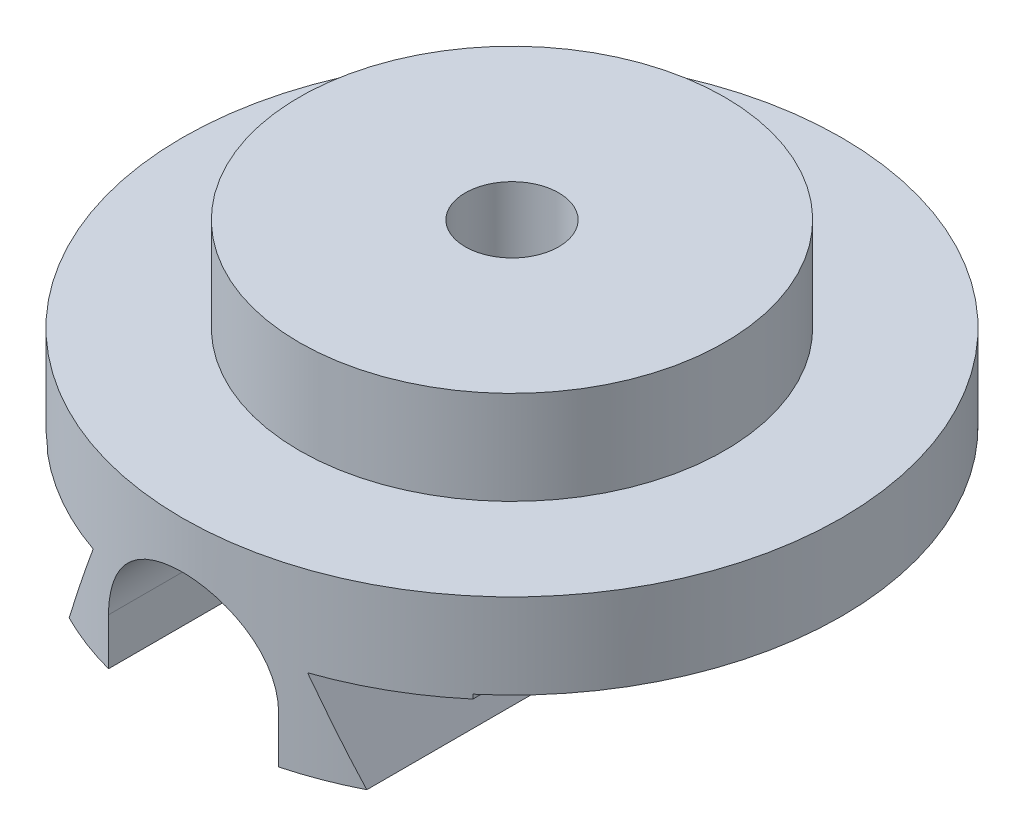
from build123d import *

# Parameters (mm, degrees)
SKETCH1_R           = 8
BOSS_EXTRUDE1_DEPTH = 77.5
SKETCH1_3_W         = 50
SKETCH1_3_H         = 22
CUT_EXTRUDE1_START  = 38
SKETCH1_4_R         = 8
CUT_EXTRUDE1_DEPTH  = 39.5
CUT_EXTRUDE2_START  = -77.5
SKETCH1_5_R         = 8
CUT_EXTRUDE2_DEPTH  = 77.5
SKETCH2_OUTSIDE_W   = 202.67
SKETCH2_OUTSIDE_H   = 202.67
SKETCH2_OUTSIDE_R   = 77.5
CUT_EXTRUDE4_DEPTH  = 77.5
SKETCH4_R           = 11
CUT_EXTRUDE5_DEPTH  = 77.5
SKETCH5_R           = 22.5
CUT_EXTRUDE6_DEPTH  = 42


with BuildPart() as part:
    # Sketch1 → Boss-Extrude1 (new, symmetric)
    with BuildSketch(Plane.XY):
        Polygon((35, 0), (25.207539179, 21), (50, 21), (50, 22), (77.5, 22), (77.5, 42), (-77.5, 42), (-77.5, 22), (-50, 22), (-50, 21), (-25.207539179, 21), (-35, 0), align=None)
        with Locations((0, 11)):
            Circle(SKETCH1_R, mode=Mode.SUBTRACT)
    extrude(amount=BOSS_EXTRUDE1_DEPTH, both=True)

    # Sketch1<3> → Revolve1 (revolve)
    with BuildSketch(Plane.XY):
        with Locations((-25, 53)):
            Rectangle(SKETCH1_3_W, SKETCH1_3_H)
    revolve(axis=Axis((0, 0, 0), (0, 1, 0)))

    # Sketch1<4> → Cut-Extrude1 (cut)
    with BuildSketch(Plane.XY.offset(CUT_EXTRUDE1_START)):
        with BuildLine():
            Line((20, 0), (20, 11))
            ThreePointArc((20, 11), (0, 31), (-20, 11))
            Line((-20, 11), (-20, 0))
            Line((-20, 0), (20, 0))
        make_face()
        with Locations((0, 11)):
            Circle(SKETCH1_4_R, mode=Mode.SUBTRACT)
    extrude(amount=CUT_EXTRUDE1_DEPTH, mode=Mode.SUBTRACT)

    # Sketch1<5> → Cut-Extrude2 (cut)
    with BuildSketch(Plane.XY.offset(CUT_EXTRUDE2_START)):
        with BuildLine():
            Line((14, 0), (14, 11))
            ThreePointArc((14, 11), (0, 25), (-14, 11))
            Line((-14, 11), (-14, 0))
            Line((-14, 0), (14, 0))
        make_face()
        with Locations((0, 11)):
            Circle(SKETCH1_5_R, mode=Mode.SUBTRACT)
    extrude(amount=CUT_EXTRUDE2_DEPTH, mode=Mode.SUBTRACT)

    # Sketch2 outside → Cut-Extrude4 (cut)
    with BuildSketch(Plane(origin=(0, 64, 0), x_dir=(1, 0, 0), z_dir=(0, 1, 0))):
        Rectangle(SKETCH2_OUTSIDE_W, SKETCH2_OUTSIDE_H)
        Circle(SKETCH2_OUTSIDE_R, mode=Mode.SUBTRACT)
    extrude(amount=-CUT_EXTRUDE4_DEPTH, mode=Mode.SUBTRACT)

    # Sketch4 → Cut-Extrude5 (cut)
    with BuildSketch(Plane(origin=(0, 64, 0), x_dir=(1, 0, 0), z_dir=(0, 1, 0))):
        Circle(SKETCH4_R)
    extrude(amount=-CUT_EXTRUDE5_DEPTH, mode=Mode.SUBTRACT)

    # Sketch5 → Cut-Extrude6 (cut)
    with BuildSketch(Plane.XZ):
        Circle(SKETCH5_R)
    extrude(amount=-CUT_EXTRUDE6_DEPTH, mode=Mode.SUBTRACT)


solid = part.part
